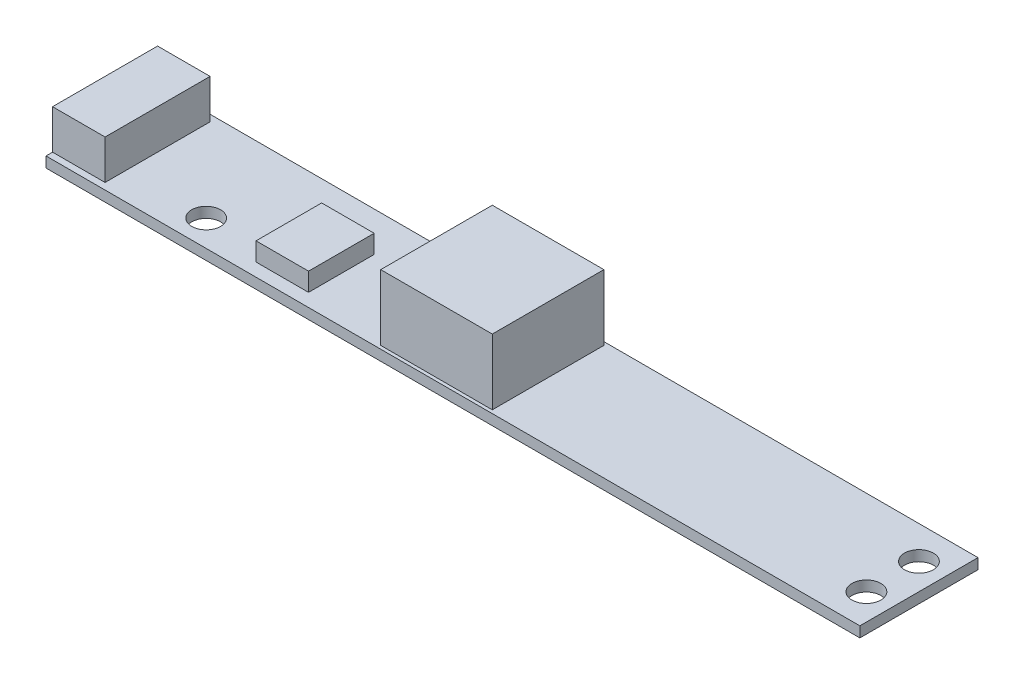
from build123d import *

# Parameters (mm, degrees)
SKETCH_1_W      = 62
SKETCH_1_H      = 9
SKETCH_1_R      = 1.1
EXTRUDE_1_DEPTH = 0.8
SKETCH_3_W      = 8.5
SKETCH_3_H      = 8.5
EXTRUDE_2_DEPTH = 5
EXTRUDE_3_DEPTH = 3
SKETCH_5_W      = 4
SKETCH_5_H      = 5
EXTRUDE_4_DEPTH = 1.4


with BuildPart() as part:
    # 草图1 → 凸台-拉伸1 (new body)
    with BuildSketch(Plane(origin=(0, 0, 0), x_dir=(1, 0, 0), z_dir=(0, 1, 0))):
        Rectangle(SKETCH_1_W, SKETCH_1_H)
        with Locations(Location((29, 2, 0), (0, 0, 270))):
            Circle(SKETCH_1_R, mode=Mode.SUBTRACT)
        with Locations(Location((29, -2, 0), (0, 0, 90))):
            Circle(SKETCH_1_R, mode=Mode.SUBTRACT)
        with Locations(Location((-20.8, -2.5, 0), (0, 0, 270))):
            Circle(SKETCH_1_R, mode=Mode.SUBTRACT)
    extrude(amount=EXTRUDE_1_DEPTH)

    # 草图3 → 凸台-拉伸2 (add)
    with BuildSketch(Plane(origin=(0, 0.8, 0), x_dir=(1, 0, 0), z_dir=(0, 1, 0))):
        with Locations((-1.5, 0)):
            Rectangle(SKETCH_3_W, SKETCH_3_H)
    extrude(amount=EXTRUDE_2_DEPTH)

    # 草图4 → 凸台-拉伸3 (add)
    with BuildSketch(Plane(origin=(0, 0.8, 0), x_dir=(1, 0, 0), z_dir=(0, 1, 0))):
        Polygon((-31, 0), (-31, 4), (-27, 4), (-27, -1.222216668), (-27, -4), (-31, -4), align=None)
    extrude(amount=EXTRUDE_3_DEPTH)

    # 草图5 → 凸台-拉伸4 (add)
    with BuildSketch(Plane(origin=(0, 0.8, 0), x_dir=(1, 0, 0), z_dir=(0, 1, 0))):
        with Locations((-14, -1)):
            Rectangle(SKETCH_5_W, SKETCH_5_H)
    extrude(amount=EXTRUDE_4_DEPTH)


solid = part.part
